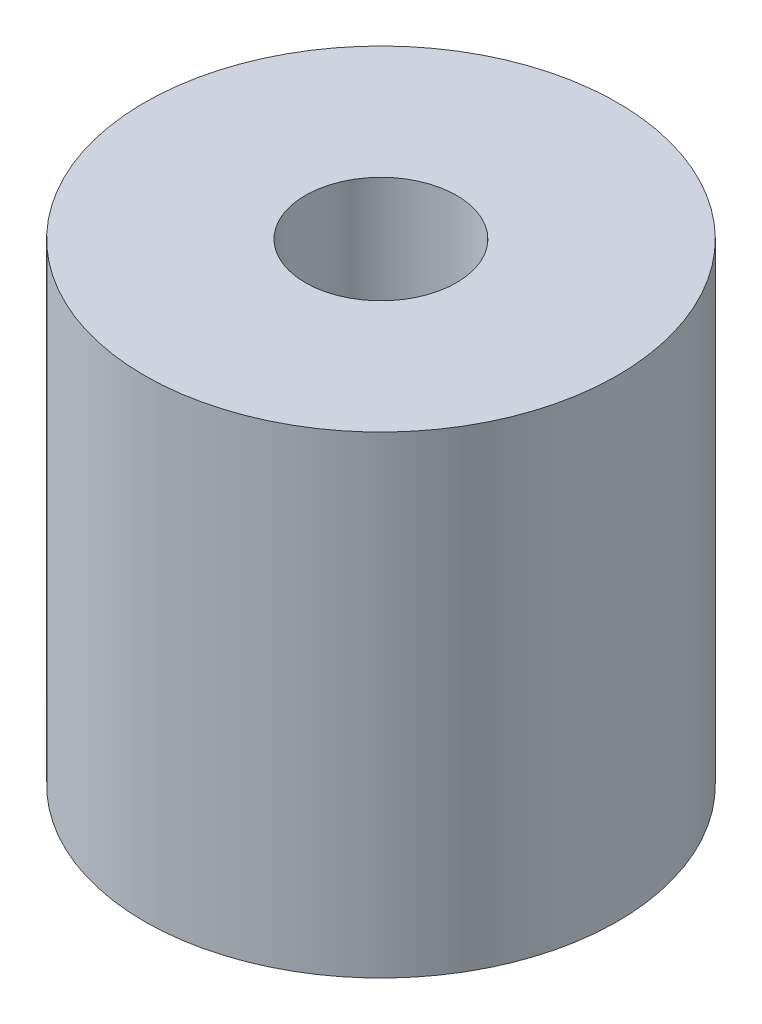
from build123d import *

# Parameters (mm, degrees)
CROQUIS1_R              = 12.5
SALIENTE_EXTRUIR1_DEPTH = 25
CROQUIS2_R              = 4
CORTAR_EXTRUIR1_DEPTH   = 15
CROQUIS3_R              = 3.175
CORTAR_EXTRUIR2_DEPTH   = 15


with BuildPart() as part:
    # Croquis1 → Saliente-Extruir1 (new body)
    with BuildSketch(Plane(origin=(0, 0, 0), x_dir=(1, 0, 0), z_dir=(0, 1, 0))):
        with Locations(Location((0, 0, 0), (0, 0, 270))):
            Circle(CROQUIS1_R)
    extrude(amount=SALIENTE_EXTRUIR1_DEPTH)

    # Croquis2 → Cortar-Extruir1 (cut)
    with BuildSketch(Plane(origin=(0, 25, 0), x_dir=(1, 0, 0), z_dir=(0, 1, 0))):
        with Locations(Location((0, 0, 0), (0, 0, 270))):
            Circle(CROQUIS2_R)
    extrude(amount=-CORTAR_EXTRUIR1_DEPTH, mode=Mode.SUBTRACT)

    # Croquis3 → Cortar-Extruir2 (cut)
    with BuildSketch(Plane.XZ):
        with Locations(Location((0, 0, 0), (0, 0, 270))):
            Circle(CROQUIS3_R)
    extrude(amount=-CORTAR_EXTRUIR2_DEPTH, mode=Mode.SUBTRACT)


solid = part.part
